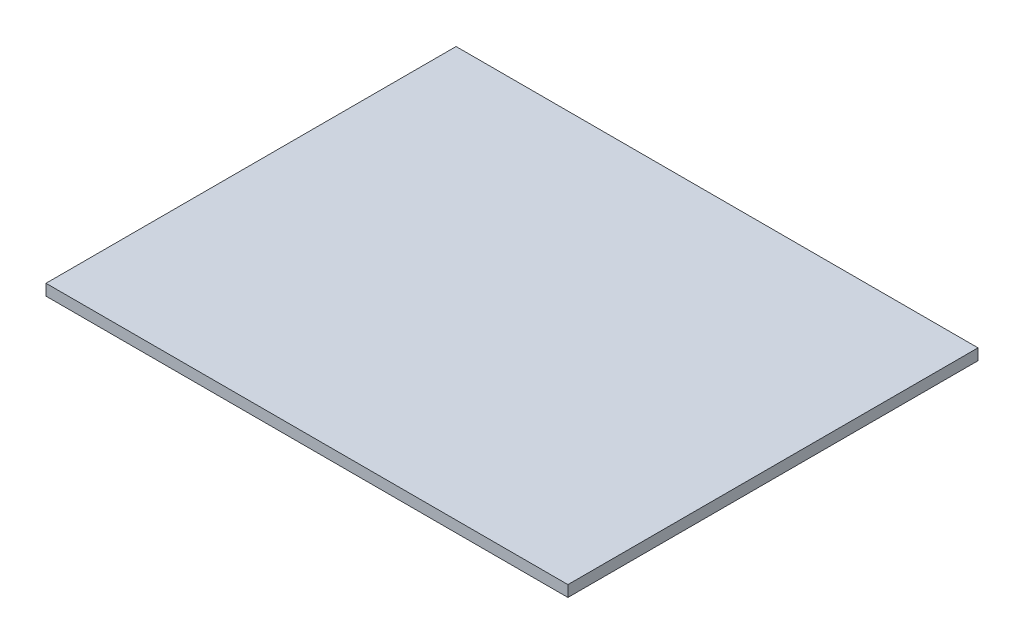
from build123d import *

# Parameters (mm, degrees)
SKETCH1_W           = 70
SKETCH1_H           = 55
BOSS_EXTRUDE1_DEPTH = 1.5


with BuildPart() as part:
    # Sketch1 → Boss-Extrude1 (new body)
    with BuildSketch(Plane(origin=(0, 0, 0), x_dir=(1, 0, 0), z_dir=(0, 1, 0))):
        Rectangle(SKETCH1_W, SKETCH1_H)
    extrude(amount=BOSS_EXTRUDE1_DEPTH)


solid = part.part
